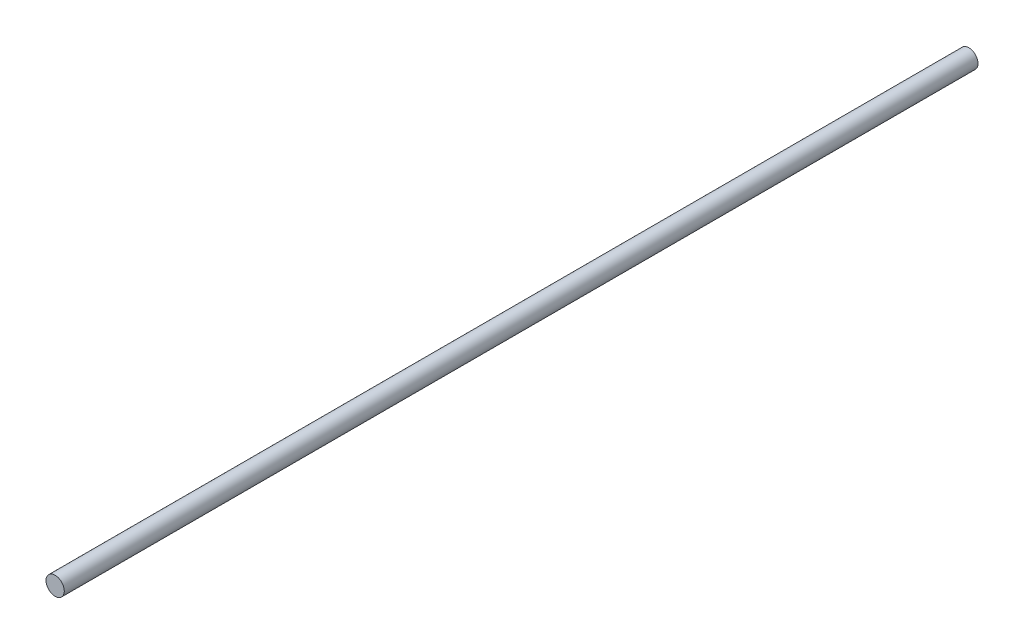
from build123d import *

# Parameters (mm, degrees)
SKETCH1_R           = 1
BOSS_EXTRUDE1_DEPTH = 100


with BuildPart() as part:
    # Sketch1 → Boss-Extrude1 (new body)
    with BuildSketch(Plane.XY):
        with Locations(Location((0, 0, 0), (0, 0, 180))):
            Circle(SKETCH1_R)
    extrude(amount=BOSS_EXTRUDE1_DEPTH)


solid = part.part
